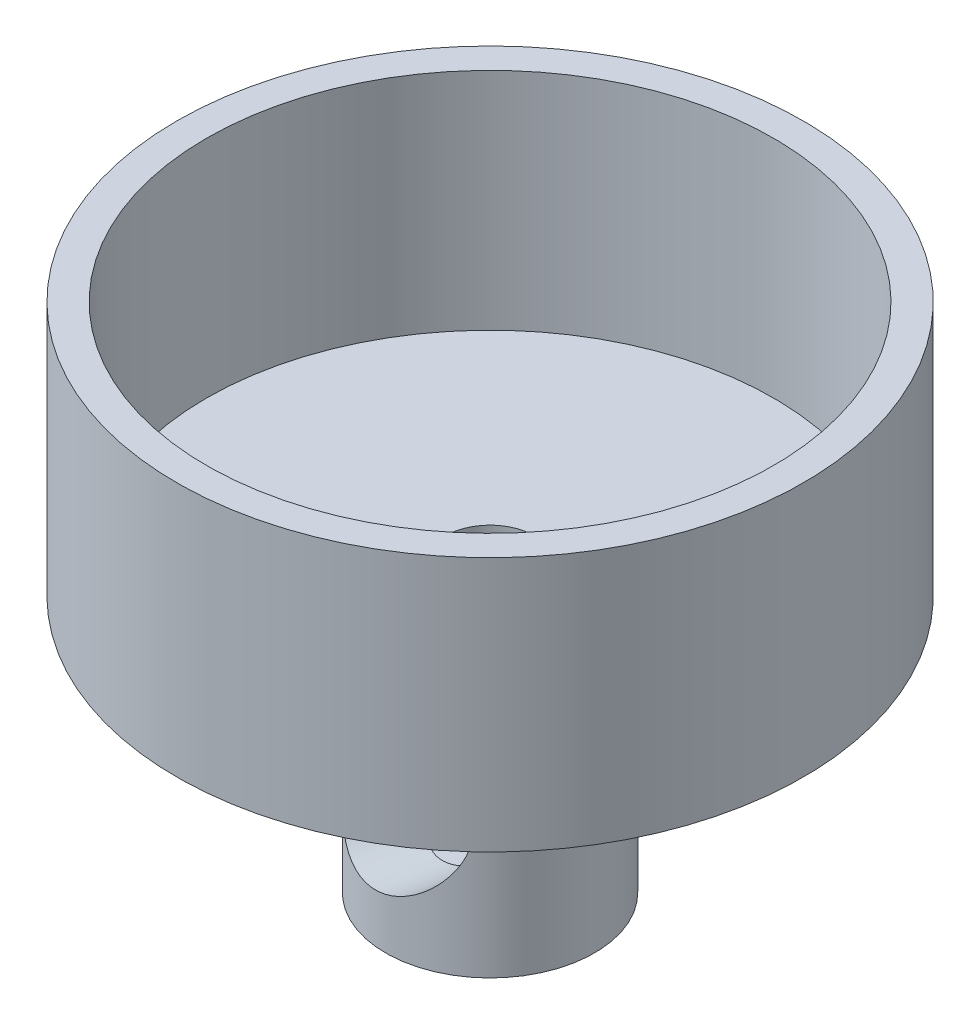
from build123d import *

# Parameters (mm, degrees)
TROU_TARAUD_G1_161_D = 10.5


with BuildPart() as part:
    # Esquisse2 → Révolution1 (revolve)
    with BuildSketch(Plane.XY):
        Polygon((-19, 19.83574186), (-19, 4.75482653), (-3, 4.75482653), (-3, 3.289391775), (-3, -12.457506315), (0, -12.457506315), (0, -14.457506315), (-4.744922372, -14.457506315), (-7, -14.457506315), (-7, 2.75482653), (-9.300232951, 2.75482653), (-21, 2.75482653), (-21, 19.83574186), align=None)
    revolve(axis=Axis((0, 8.523766276, 0), (0, -1, 0)))

    # Trou taraudé G1/161 (through all)
    with Locations(Plane(origin=(1.240708844, -5.954064023, -6.889168423), x_dir=(-0.984166917609, 0, -0.17724412059), z_dir=(0.17724412059, 0, -0.984166917609))):
        with Locations((0, 0)):
            Hole(TROU_TARAUD_G1_161_D / 2)


solid = part.part
